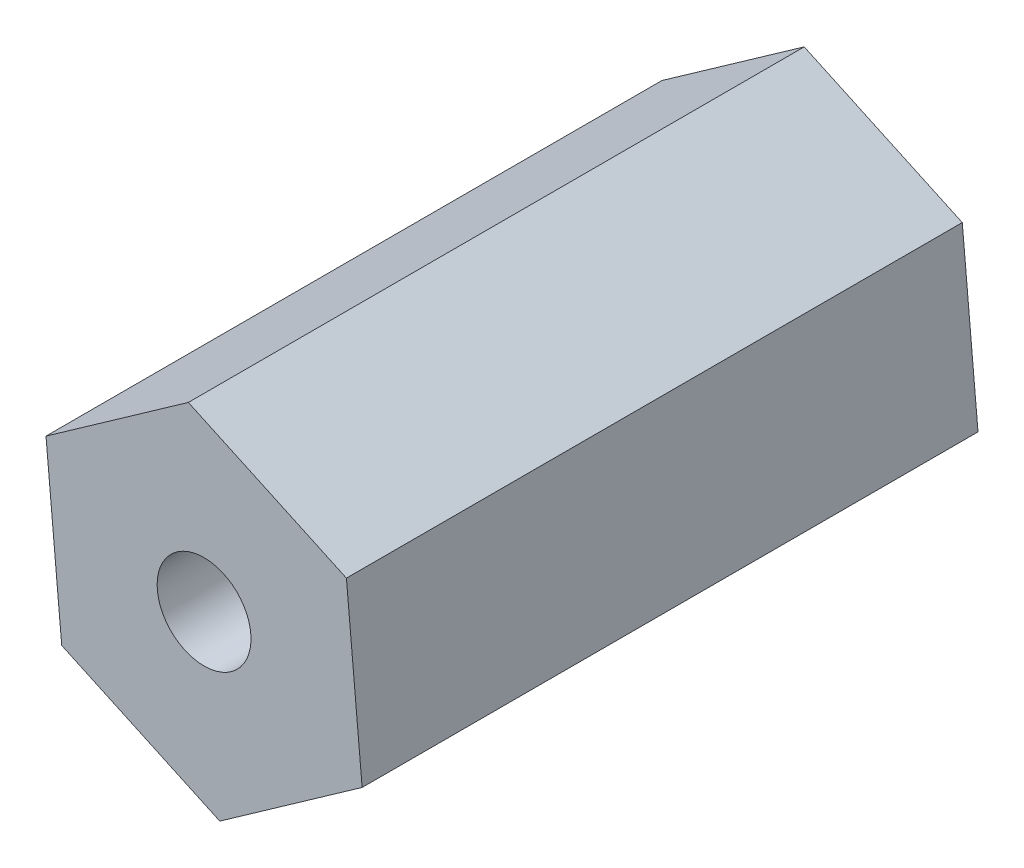
from build123d import *

# Parameters (mm, degrees)
BOSS_EXTRUDE1_DEPTH               = 52.07
F_3_8_16_TAPPED_HOLE1_D           = 7.9375
F_3_8_16_TAPPED_HOLE1_CSINK_D     = 10.795
F_3_8_16_TAPPED_HOLE1_CSINK_ANGLE = 90


with BuildPart() as part:
    # Sketch1 → Boss-Extrude1 (new body)
    with BuildSketch(Plane.XY):
        Polygon((13.364388917, -6.181593058), (12.035611083, 8.483103779), (-1.328777834, 14.664696837), (-13.364388917, 6.181593058), (-12.035611083, -8.483103779), (1.328777834, -14.664696837), align=None)
    extrude(amount=BOSS_EXTRUDE1_DEPTH)

    # 3/8-16 Tapped Hole1 (through all)
    with Locations(Plane(origin=(0, 0, 0), x_dir=(-1, 0, 0), z_dir=(0, 0, -1))):
        with Locations((0, 0)):
            CounterSinkHole(F_3_8_16_TAPPED_HOLE1_D / 2, F_3_8_16_TAPPED_HOLE1_CSINK_D / 2, counter_sink_angle=F_3_8_16_TAPPED_HOLE1_CSINK_ANGLE)


solid = part.part
